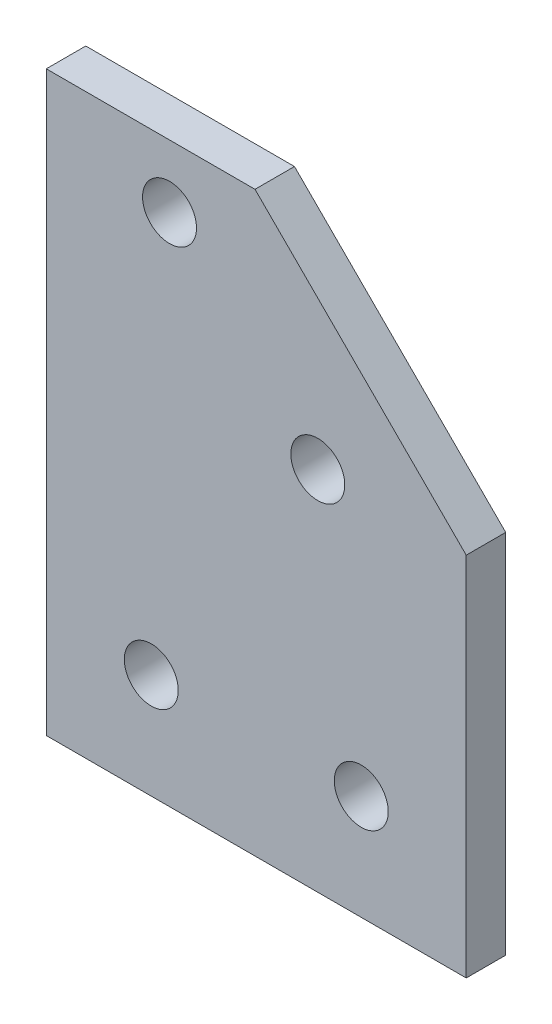
from build123d import *

# Parameters (mm, degrees)
SKETCH1_R           = 3.2639
BOSS_EXTRUDE1_DEPTH = 4.7752


with BuildPart() as part:
    # Sketch1 → Boss-Extrude1 (new body)
    with BuildSketch(Plane.XY.offset(2.3876)):
        Polygon((25.4, 9.3726), (-0.1524, 34.925), (-25.4, 34.925), (-25.4, -34.925), (25.4, -34.925), align=None)
        with Locations(Location((-10.4902, 27.3304, 0), (0, 0, 180))):
            Circle(SKETCH1_R, mode=Mode.SUBTRACT)
        with Locations(Location((-12.7, -22.225, 0), (0, 0, 180))):
            Circle(SKETCH1_R, mode=Mode.SUBTRACT)
        with Locations(Location((7.4422, 9.3726, 0), (0, 0, 180))):
            Circle(SKETCH1_R, mode=Mode.SUBTRACT)
        with Locations(Location((12.7, -22.225, 0), (0, 0, 180))):
            Circle(SKETCH1_R, mode=Mode.SUBTRACT)
    extrude(amount=-BOSS_EXTRUDE1_DEPTH)


solid = part.part
